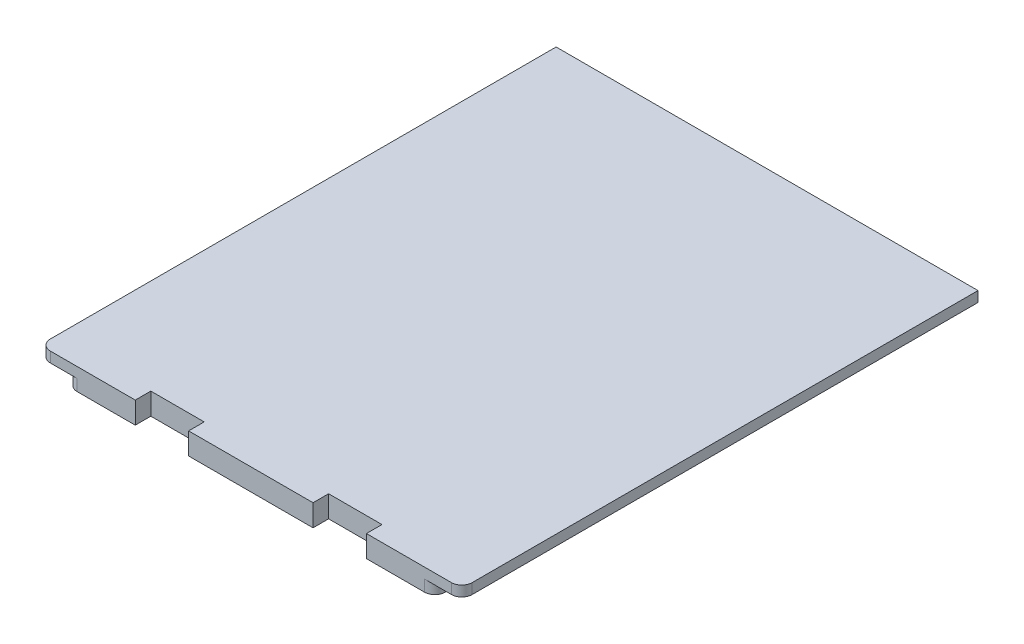
from build123d import *

# Parameters (mm, degrees)
BOSS_EXTRUDE1_DEPTH = 99.6
FILLET1_R           = 2
SKETCH3_W           = 10.297809691
SKETCH3_H           = 3
CUT_EXTRUDE1_DEPTH  = 5
FILLET2_R           = 2


with BuildPart() as part:
    # Sketch2 → Boss-Extrude1 (new body)
    with BuildSketch(Plane.XY):
        Polygon((35.5, 0), (-35.5, 0), (-35.5, 2.2), (-40.7, 2.2), (-40.7, 4.2), (40.7, 4.2), (40.7, 2.2), (35.5, 2.2), align=None)
    extrude(amount=BOSS_EXTRUDE1_DEPTH)

    # Fillet1
    fillet1_edges = [part.edges().sort_by_distance(p)[0] for p in [
        (40.7, 3.2, 99.6),
        (-40.7, 3.2, 99.6),
    ]]
    fillet(fillet1_edges, radius=FILLET1_R)

    # Sketch3 → Cut-Extrude1 (cut)
    with BuildSketch(Plane(origin=(0, 0, 0), x_dir=(-1, 0, 0), z_dir=(0, -1, 0))):
        with Locations((17.151095155, -98.1)):
            Rectangle(SKETCH3_W, SKETCH3_H)
        with Locations((-17.151095155, -98.1)):
            Rectangle(SKETCH3_W, SKETCH3_H)
    extrude(amount=-CUT_EXTRUDE1_DEPTH, mode=Mode.SUBTRACT)

    # Fillet2
    fillet2_edges = [part.edges().sort_by_distance(p)[0] for p in [
        (35.5, 1.1, 99.6),
        (-35.5, 1.1, 99.6),
    ]]
    fillet(fillet2_edges, radius=FILLET2_R)


solid = part.part
